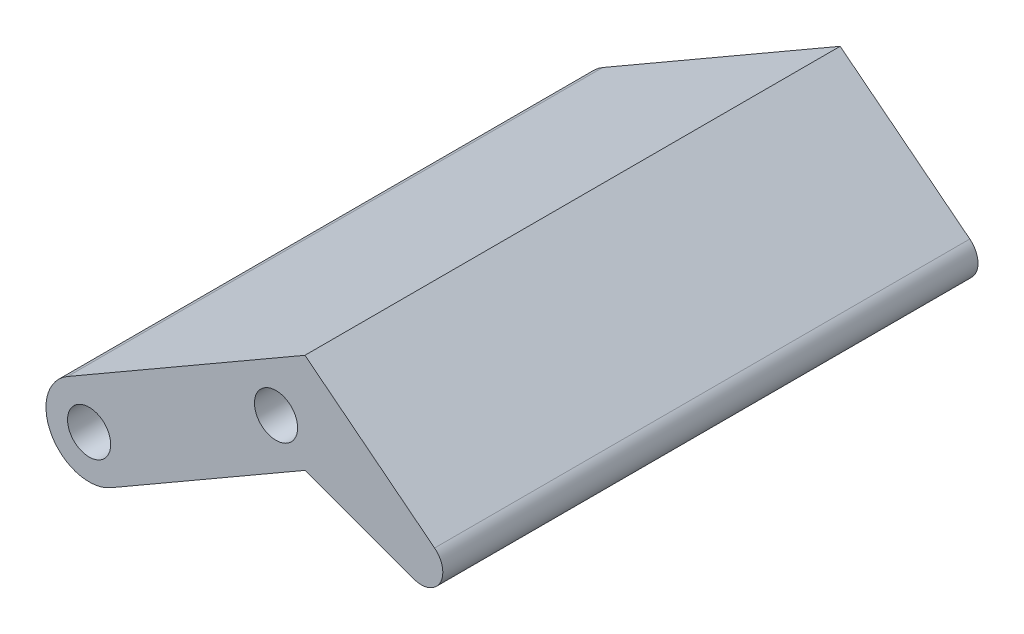
from build123d import *

# Parameters (mm, degrees)
SKETCH_1_R               = 10
SKETCH_1_R_2             = 2.5
EXTRUDE_1_DEPTH          = 70
SKETCH_2_W               = 60
SKETCH_2_H               = 70
SKETCH_2_H_2             = 67.94057246
CUT_EXTRUDE_1_DEPTH      = 70
EXTRUDE_2_DEPTH          = 60
EXTRUDE_3_DEPTH          = 60
CUT_EXTRUDE_3_DEPTH      = 129.790186287
CUT_EXTRUDE_3_DEPTH_BACK = 129.790186287
SKETCH_6_R               = 2.5
CUT_EXTRUDE_4_DEPTH      = 132.384596068
CUT_EXTRUDE_4_DEPTH_BACK = 132.384596068
SKETCH_7_W               = 41.69897569
SKETCH_7_H               = 124.994220232
SKETCH_7_W_2             = 29.374155289
SKETCH_7_H_2             = 127.870011659
CUT_EXTRUDE_5_DEPTH      = 99.780560832
CUT_EXTRUDE_5_DEPTH_BACK = 99.780560832
SKETCH_9_R               = 2.5
EXTRUDE_4_DEPTH          = 2


with BuildPart() as part:
    # 草图1 → 凸台-拉伸1 (new body)
    with BuildSketch(Plane.XY):
        with BuildLine():
            Line((-15, 90), (-15, 0))
            ThreePointArc((-15, 0), (0, -15), (15, 0))
            Line((15, 0), (15, 90))
            ThreePointArc((15, 90), (0, 105), (-15, 90))
        make_face()
        Circle(SKETCH_1_R, mode=Mode.SUBTRACT)
        with Locations((0, 90)):
            Circle(SKETCH_1_R_2, mode=Mode.SUBTRACT)
    extrude(amount=EXTRUDE_1_DEPTH)

    # 草图2 → 切除-拉伸1 (cut)
    with BuildSketch(Plane.ZY.offset(15)):
        with Locations((35, 80)):
            Rectangle(SKETCH_2_W, SKETCH_2_H)
        with Locations((35, 11.02971377)):
            Rectangle(SKETCH_2_W, SKETCH_2_H_2)
    extrude(amount=-CUT_EXTRUDE_1_DEPTH, mode=Mode.SUBTRACT)


with BuildPart() as cut_extrude_1_piece_1:
    # of the separate pieces the step leaves, piece 1, a body of its own (cut_extrude_1_pieces)
    add(part.part.solids().sort_by_distance((15, 0, 0))[0])



with BuildPart() as cut_extrude_1_piece_2:
    # of the separate pieces the step leaves, piece 2, a body of its own (cut_extrude_1_pieces)
    add(part.part.solids().sort_by_distance((15, 0, 65))[0])


with BuildPart() as cut_extrude_1_piece_1_1:
    add(cut_extrude_1_piece_1.part)

    add(cut_extrude_1_piece_2.part)  # 凸台-拉伸2 merges 切除-拉伸1 piece 2
    # 草图4 → 凸台-拉伸2 (add)
    with BuildSketch(Plane(origin=(0, 0, 65), x_dir=(-1, 0, 0), z_dir=(0, 0, -1))):
        with BuildLine():
            Line((-4.490156776, 68.758657712), (15, 57.50601045))
            Line((15, 57.50601045), (36.319312502, 12.911360415))
            ThreePointArc((36.319312502, 12.911360415), (35.142094618, 9.577570071), (31.808304274, 10.754787955))
            Line((31.808304274, 10.754787955), (15, 45.913541163))
            Line((15, 45.913541163), (-9.509843224, 60.064305746))
            ThreePointArc((-9.509843224, 60.064305746), (-11.347175983, 66.921324953), (-4.490156776, 68.758657712))
        make_face()
    extrude(amount=EXTRUDE_2_DEPTH)

    # 草图5 → 凸台-拉伸3 (add)
    with BuildSketch(Plane(origin=(0, 0, 65), x_dir=(-1, 0, 0), z_dir=(0, 0, -1))):
        with BuildLine():
            Line((-30.017605928, 49.094069219), (-15, 60.919508718))
            Line((-15, 60.919508718), (12.5, 45.042376315))
            ThreePointArc((12.5, 45.042376315), (14.330127019, 38.212249296), (7.5, 36.382122277))
            Line((7.5, 36.382122277), (-15, 49.372503334))
            Line((-15, 49.372503334), (-27.615908762, 44.780688066))
            ThreePointArc((-27.615908762, 44.780688066), (-30.655195979, 45.913733224), (-30.017605928, 49.094069219))
        make_face()
    extrude(amount=EXTRUDE_3_DEPTH)

    # 草图6 → 切除-拉伸3 (cut, two sides: drawn at the far end of the back side and taken through both)
    with BuildSketch(Plane(origin=(0, 0, 65), x_dir=(-1, 0, 0), z_dir=(0, 0, -1)).offset(-CUT_EXTRUDE_3_DEPTH_BACK)):
        with Locations(Location((-7, 64.411481729, 0), (0, 0, 90))):
            Circle(SKETCH_6_R)
        with Locations(Location((-11.650635095, 53.212249296, 0), (0, 0, 90))):
            Circle(SKETCH_6_R)
        with Locations(Location((10, 40.712249296, 0), (0, 0, 90))):
            Circle(SKETCH_6_R)
        with Locations(Location((10.320508076, 54.411481729, 0), (0, 0, 90))):
            Circle(SKETCH_6_R)
    extrude(amount=CUT_EXTRUDE_3_DEPTH + CUT_EXTRUDE_3_DEPTH_BACK, mode=Mode.SUBTRACT)

    # 草图7 → 切除-拉伸4 (cut, two sides: drawn at the far end of the back side and taken through both)
    with BuildSketch(Plane(origin=(0, 0, 0), x_dir=(0, 0, -1), z_dir=(1, 0, 0)).offset(-CUT_EXTRUDE_4_DEPTH_BACK)):
        with Locations((15.849487845, 45.30812051)):
            Rectangle(SKETCH_7_W, SKETCH_7_H)
        with Locations((-79.687077644, 43.870224797)):
            Rectangle(SKETCH_7_W_2, SKETCH_7_H_2)
    extrude(amount=CUT_EXTRUDE_4_DEPTH + CUT_EXTRUDE_4_DEPTH_BACK, mode=Mode.SUBTRACT)


with BuildPart() as cut_extrude_4_piece_1:
    # of the separate pieces the step leaves, piece 1, a body of its own (cut_extrude_4_pieces)
    add(cut_extrude_1_piece_1_1.part.solids().sort_by_distance((-15, 45.913541163, 65))[0])

    # 草图8 → 切除-拉伸5 (cut, two sides: drawn at the far end of the back side and taken through both)
    with BuildSketch(Plane(origin=(0, 0, 5), x_dir=(-1, 0, 0), z_dir=(0, 0, -1)).offset(-CUT_EXTRUDE_5_DEPTH_BACK)):
        Polygon((-6.948831874, 74.137409514), (-14.942987604, 67.665950114), (-12.735077926, 60.813816632), (14.064377472, 45.130044439), (31.727654893, 6.225153222), (50.98976346, 4.626322076), (26.322082923, 67.665950114), align=None)
    extrude(amount=CUT_EXTRUDE_5_DEPTH + CUT_EXTRUDE_5_DEPTH_BACK, mode=Mode.SUBTRACT)


with BuildPart() as cut_extrude_4_piece_2:
    # of the separate pieces the step leaves, piece 2, a body of its own (cut_extrude_4_pieces)
    add(cut_extrude_1_piece_1_1.part.solids().sort_by_distance((27.615908762, 44.780688066, 65))[0])

    # 草图9 → 凸台-拉伸4 (add)
    with BuildSketch(Plane(origin=(0, 0, 5), x_dir=(-1, 0, 0), z_dir=(0, 0, -1))):
        with BuildLine():
            Line((-27.615908762, 44.780688066), (-15, 49.372503334))
            Line((-15, 49.372503334), (7.5, 36.382122277))
            ThreePointArc((7.5, 36.382122277), (14.330127019, 38.212249296), (12.5, 45.042376315))
            Line((12.5, 45.042376315), (-15, 60.919508718))
            Line((-15, 60.919508718), (-30.017605928, 49.094069219))
            ThreePointArc((-30.017605928, 49.094069219), (-30.655195979, 45.913733224), (-27.615908762, 44.780688066))
        make_face()
        with Locations(Location((-11.650635095, 53.212249296, 0), (0, 0, 90))):
            Circle(SKETCH_9_R, mode=Mode.SUBTRACT)
        with Locations(Location((10, 40.712249296, 0), (0, 0, 90))):
            Circle(SKETCH_9_R, mode=Mode.SUBTRACT)
    extrude(amount=EXTRUDE_4_DEPTH)


solid = cut_extrude_4_piece_2.part
